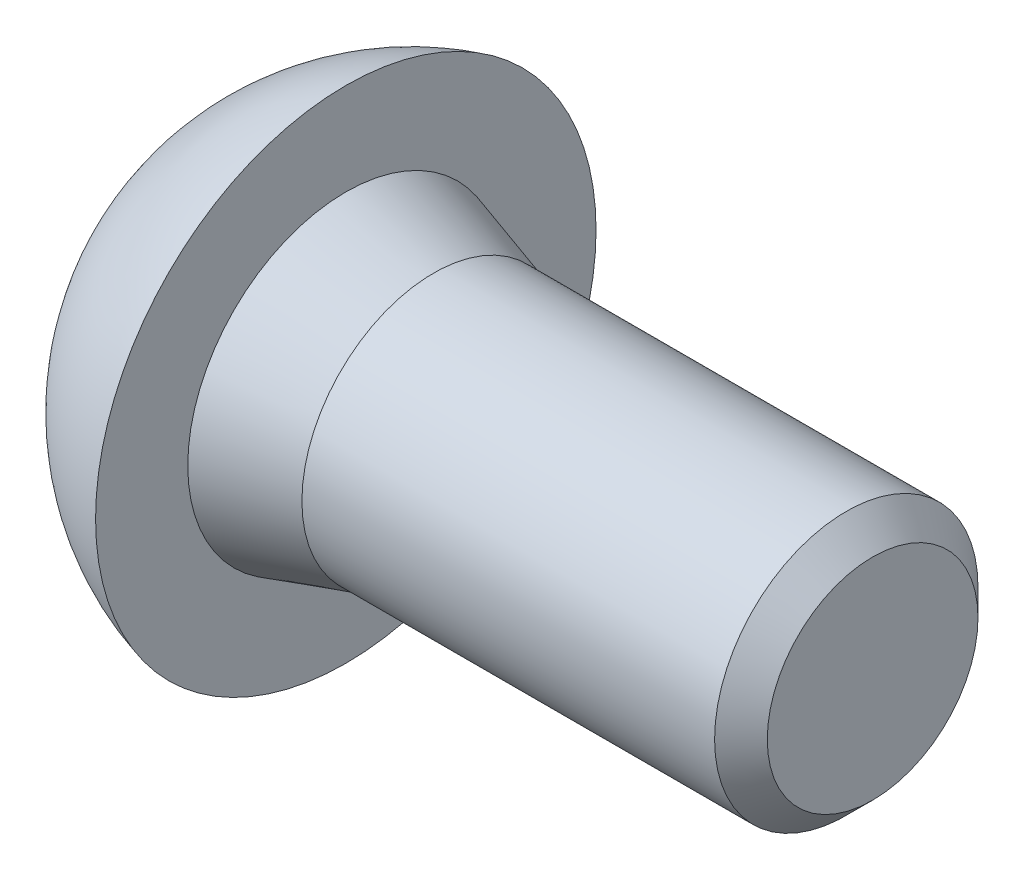
from build123d import *

# Parameters (mm, degrees)
CUT_EXTRUDE_1_DEPTH = 1.04
CHAMFER_1_SIZE      = 0.3


with BuildPart() as part:
    # 草图1 → 旋转1 (revolve)
    with BuildSketch(Plane.XY, mode=Mode.PRIVATE) as revolve_1_sk:
        with BuildLine():
            Line((0, 0), (0, 1.5))
            Line((0, 1.5), (-5, 1.5))
            Line((-5, 1.5), (-6, 1.8))
            Line((-6, 1.8), (-6, 2.85))
            ThreePointArc((-6, 2.85), (-6.924953874, 2.424670081), (-7.65, 1.71))
            Line((-7.65, 1.71), (-7.65, 0))
            Line((-7.65, 0), (0, 0))
        make_face()
    revolve(revolve_1_sk.sketch.rotate(Axis((0, 0, 0), (-1, 0, 0)), 90), axis=Axis((0, 0, 0), (-1, 0, 0)))

    # 草图4 → 切除-拉伸1 (cut)
    with BuildSketch(Plane.ZY.offset(7.65)):
        Polygon((0, 1.154700538), (-1, 0.577350269), (-1, -0.577350269), (0, -1.154700538), (1, -0.577350269), (1, 0.577350269), align=None)
    extrude(amount=-CUT_EXTRUDE_1_DEPTH, mode=Mode.SUBTRACT)

    # 倒角1
    chamfer_1_edges = [part.edges().sort_by_distance(p)[0] for p in [
        (0, 0, 1.5),
    ]]
    chamfer(chamfer_1_edges, length=CHAMFER_1_SIZE)

    # 草图6 → 切除-放样1 section 0
    with BuildSketch(Plane.ZY.offset(6.61), mode=Mode.PRIVATE) as loft_1_s0:
        with BuildLine():
            Line((0, 1.154700538), (-1, 0.577350269))
            Line((-1, 0.577350269), (-1, -0.577350269))
            Line((-1, -0.577350269), (0, -1.154700538))
            Line((0, -1.154700538), (1, -0.577350269))
            Line((1, -0.577350269), (1, 0.577350269))
            Line((1, 0.577350269), (0, 1.154700538))
        make_face()
    loft([Vertex(-6.40375, 0, 0), loft_1_s0.sketch], mode=Mode.SUBTRACT)


solid = part.part
